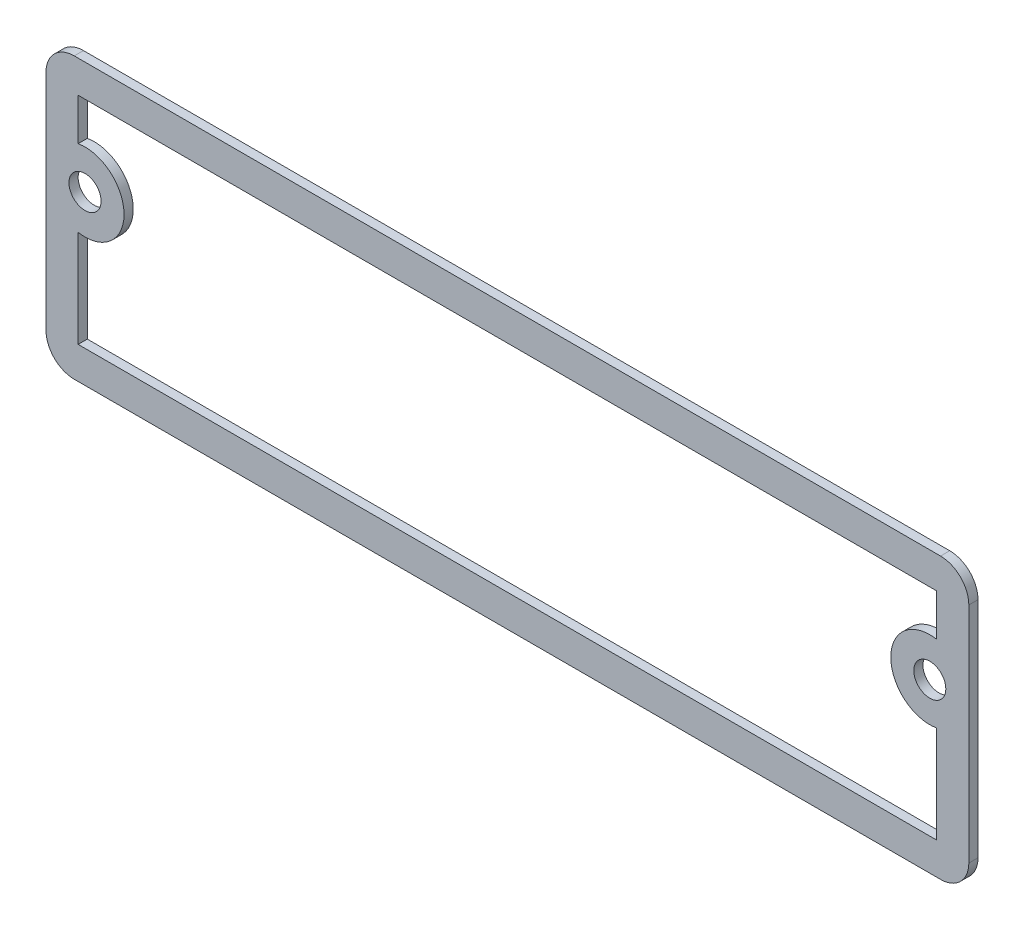
from build123d import *

# Parameters (mm, degrees)
SKETCH2_R           = 1.75
BOSS_EXTRUDE1_DEPTH = 1
BOSS_EXTRUDE3_START = -1
SKETCH4_R           = 1.75
SKETCH4_R_2         = 1.744098306
BOSS_EXTRUDE3_DEPTH = 1


with BuildPart() as part:
    # Sketch2 → Boss-Extrude1 (new body)
    with BuildSketch(Plane.XY):
        with BuildLine():
            Line((0, 3), (0, 27))
            ThreePointArc((0, 27), (-0.878679656, 29.121320344), (-3, 30))
            Line((-3, 30), (-97, 30))
            ThreePointArc((-97, 30), (-99.121320344, 29.121320344), (-100, 27))
            Line((-100, 27), (-100, 3))
            ThreePointArc((-100, 3), (-99.121320344, 0.878679656), (-97, 0))
            Line((-97, 0), (-3, 0))
            ThreePointArc((-3, 0), (-0.878679656, 0.878679656), (0, 3))
        make_face()
        with Locations((-96, 18)):
            Circle(SKETCH2_R, mode=Mode.SUBTRACT)
        with Locations((-4, 18)):
            Circle(SKETCH2_R, mode=Mode.SUBTRACT)
        with BuildLine():
            Line((-97, 27), (-3, 27))
            Line((-3, 27), (-3, 21.872983346))
            ThreePointArc((-3, 21.872983346), (-8, 18), (-3, 14.127016654))
            Line((-3, 14.127016654), (-3, 3))
            Line((-3, 3), (-97, 3))
            Line((-97, 3), (-97, 14.127016654))
            ThreePointArc((-97, 14.127016654), (-92, 18), (-97, 21.872983346))
            Line((-97, 21.872983346), (-97, 27))
        make_face(mode=Mode.SUBTRACT)
    extrude(amount=BOSS_EXTRUDE1_DEPTH)

    # Sketch4 → Boss-Extrude3 (add)
    with BuildSketch(Plane.XY.offset(1).offset(BOSS_EXTRUDE3_START)):
        with BuildLine():
            Line((-97.171540794, 30.25), (-2.828459206, 30.25))
            ThreePointArc((-2.828459206, 30.25), (-0.651659826, 29.348340174), (0.25, 27.171540794))
            Line((0.25, 27.171540794), (0.25, 2.828459206))
            ThreePointArc((0.25, 2.828459206), (-0.651659826, 0.651659826), (-2.828459206, -0.25))
            Line((-2.828459206, -0.25), (-97.171540794, -0.25))
            ThreePointArc((-97.171540794, -0.25), (-99.348340174, 0.651659826), (-100.25, 2.828459206))
            Line((-100.25, 2.828459206), (-100.25, 27.171540794))
            ThreePointArc((-100.25, 27.171540794), (-99.348340174, 29.348340174), (-97.171540794, 30.25))
        make_face()
        with Locations((-96, 18)):
            Circle(SKETCH4_R, mode=Mode.SUBTRACT)
        with Locations((-4, 18)):
            Circle(SKETCH4_R_2, mode=Mode.SUBTRACT)
        with BuildLine():
            Line((-96.75, 26.75), (-3.25, 26.75))
            Line((-3.25, 26.75), (-3.25, 22.183300133))
            ThreePointArc((-3.25, 22.183300133), (-8.25, 18), (-3.25, 13.816699867))
            Line((-3.25, 13.816699867), (-3.25, 3.25))
            Line((-3.25, 3.25), (-96.75, 3.25))
            Line((-96.75, 3.25), (-96.75, 13.816699867))
            ThreePointArc((-96.75, 13.816699867), (-91.75, 18), (-96.75, 22.183300133))
            Line((-96.75, 22.183300133), (-96.75, 26.75))
        make_face(mode=Mode.SUBTRACT)
    extrude(amount=BOSS_EXTRUDE3_DEPTH)


solid = part.part
